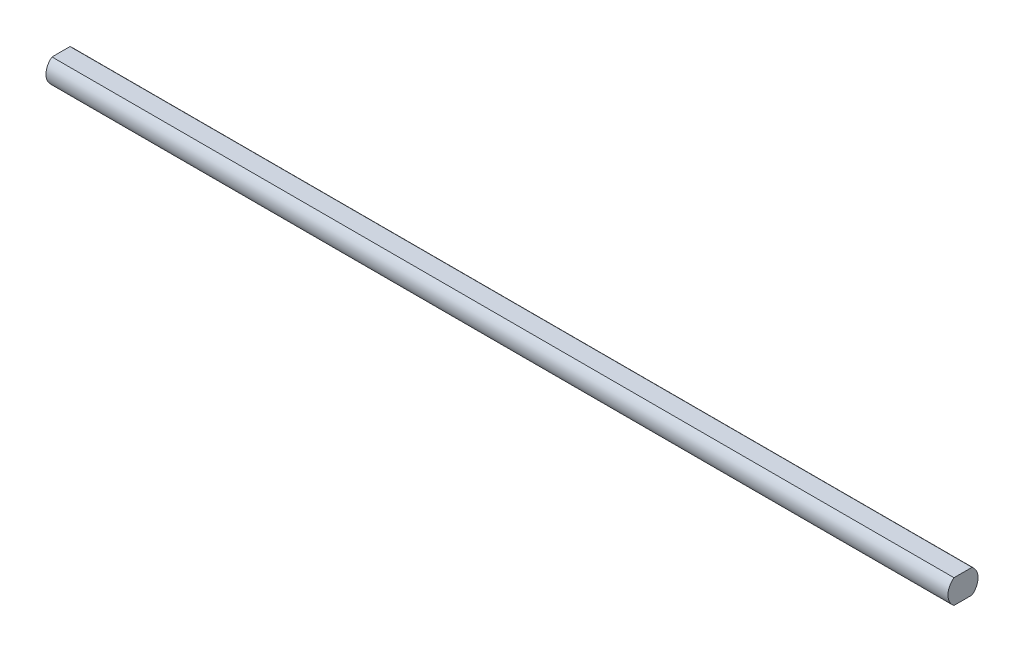
from build123d import *

# Parameters (mm, degrees)
SKETCH1_W          = 300
SKETCH1_H          = 5
CUT_EXTRUDE1_START = -300
CUT_EXTRUDE1_DEPTH = 300


with BuildPart() as part:
    # Sketch1 → Revolve1 (revolve)
    with BuildSketch(Plane.XY, mode=Mode.PRIVATE) as revolve1_sk:
        with Locations((0, -2.5)):
            Rectangle(SKETCH1_W, SKETCH1_H)
    revolve(revolve1_sk.sketch.rotate(Axis((-150, 0, 0), (1, 0, 0)), 270), axis=Axis((-150, 0, 0), (1, 0, 0)))

    # Sketch2 → Cut-Extrude1 (cut)
    with BuildSketch(Plane(origin=(150, 0, 0), x_dir=(0, 0, -1), z_dir=(1, 0, 0)).offset(CUT_EXTRUDE1_START)):
        with BuildLine():
            Line((3, -4), (-3, -4))
            ThreePointArc((-3, -4), (0, -5), (3, -4))
        make_face()
        with BuildLine():
            ThreePointArc((-3, 4), (0, 5), (3, 4))
            Line((3, 4), (-3, 4))
        make_face()
    extrude(amount=CUT_EXTRUDE1_DEPTH, mode=Mode.SUBTRACT)


solid = part.part
